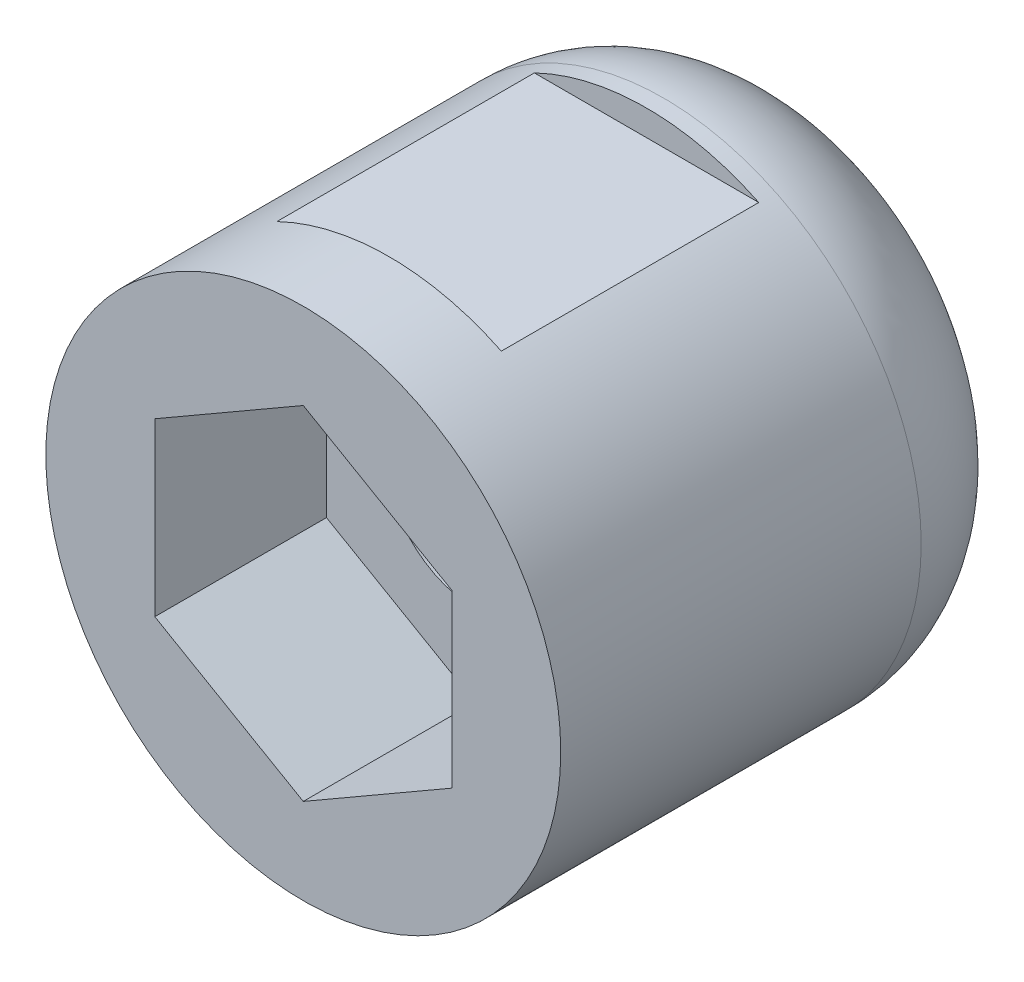
from build123d import *

# Parameters (mm, degrees)
SKETCH_1_R               = 15
SKETCH_1_R_2             = 5.25
EXTRUDE_1_DEPTH          = 14.5
CUT_EXTRUDE_1_DEPTH      = 10
FILLET_2_R               = 8
CUT_EXTRUDE_2_DEPTH      = 26.695330315
CUT_EXTRUDE_2_DEPTH_BACK = 26.695330315
SKETCH_3_W               = 15
SKETCH_3_H               = 1.5


with BuildPart() as part:
    # 草图1 → 凸台-拉伸1 (new, symmetric)
    with BuildSketch(Plane.XY):
        with Locations(Location((0, 0, 0), (0, 0, 180))):
            Circle(SKETCH_1_R)
        with Locations(Location((0, 0, 0), (0, 0, 180))):
            Circle(SKETCH_1_R_2, mode=Mode.SUBTRACT)
    extrude(amount=EXTRUDE_1_DEPTH, both=True)

    # 草图2 → 切除-拉伸1 (cut)
    with BuildSketch(Plane.XY.offset(14.5)):
        Polygon((0, 9.988159657), (-8.65, 4.994079828), (-8.65, -4.994079828), (0, -9.988159657), (8.65, -4.994079828), (8.65, 4.994079828), align=None)
    extrude(amount=-CUT_EXTRUDE_1_DEPTH, mode=Mode.SUBTRACT)

    # 圆角2
    fillet_2_edges = [part.edges().sort_by_distance(p)[0] for p in [
        (15, 0, -14.5),
    ]]
    fillet(fillet_2_edges, radius=FILLET_2_R)

    # 草图3 → 切除-拉伸2 (cut, two sides: drawn at the far end of the back side and taken through both)
    with BuildSketch(Plane(origin=(0, 0, 0), x_dir=(0, 0, -1), z_dir=(1, 0, 0)).offset(-CUT_EXTRUDE_2_DEPTH_BACK)):
        with Locations((-2, 14.25)):
            Rectangle(SKETCH_3_W, SKETCH_3_H)
        with Locations((-2, -14.25)):
            Rectangle(SKETCH_3_W, SKETCH_3_H)
    extrude(amount=CUT_EXTRUDE_2_DEPTH + CUT_EXTRUDE_2_DEPTH_BACK, mode=Mode.SUBTRACT)


solid = part.part
